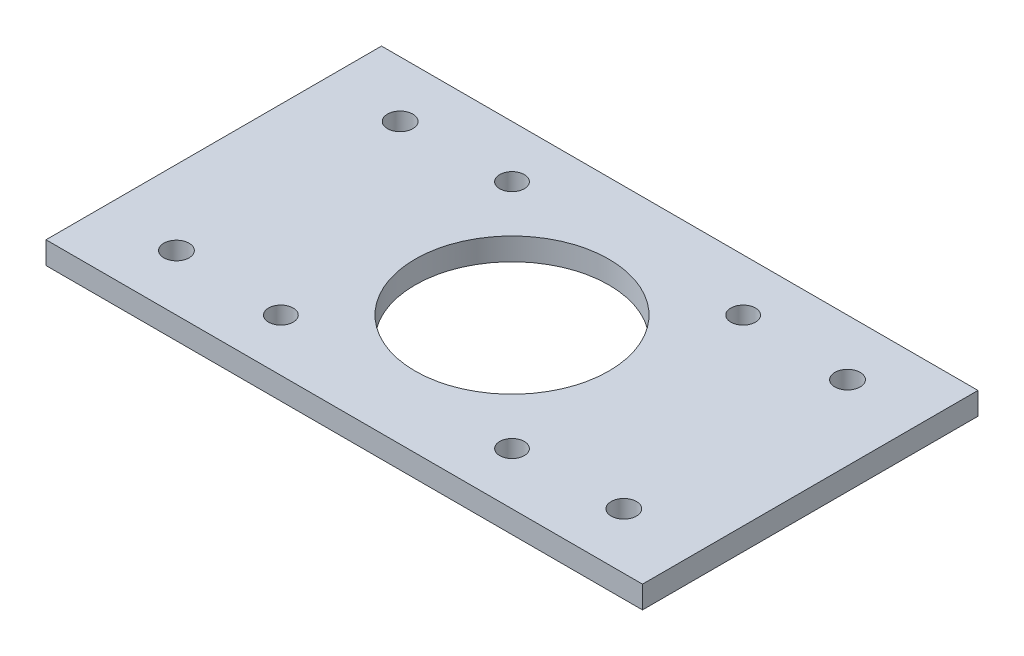
from build123d import *

# Parameters (mm, degrees)
SKETCH_1_W          = 80
SKETCH_1_H          = 45
EXTRUDE_1_DEPTH     = 3
SKETCH_2_R          = 1.65
CUT_EXTRUDE_1_DEPTH = 3
SKETCH_3_R          = 13
CUT_EXTRUDE_2_DEPTH = 10
SKETCH_5_R          = 1.7
CUT_EXTRUDE_4_DEPTH = 10


with BuildPart() as part:
    # 草图1 → 凸台-拉伸1 (new body)
    with BuildSketch(Plane(origin=(0, 0, 0), x_dir=(1, 0, 0), z_dir=(0, 1, 0))):
        Rectangle(SKETCH_1_W, SKETCH_1_H)
    extrude(amount=EXTRUDE_1_DEPTH)

    # 草图2 → 切除-拉伸1 (cut)
    with BuildSketch(Plane(origin=(0, 3, 0), x_dir=(1, 0, 0), z_dir=(0, 1, 0))):
        with Locations(Location((-15.5, 15.5, 0), (0, 0, 270))):
            Circle(SKETCH_2_R)
        with Locations(Location((15.5, 15.5, 0), (0, 0, 270))):
            Circle(SKETCH_2_R)
        with Locations(Location((-15.5, -15.5, 0), (0, 0, 270))):
            Circle(SKETCH_2_R)
        with Locations(Location((15.5, -15.5, 0), (0, 0, 270))):
            Circle(SKETCH_2_R)
    extrude(amount=-CUT_EXTRUDE_1_DEPTH, mode=Mode.SUBTRACT)

    # 草图3 → 切除-拉伸2 (cut)
    with BuildSketch(Plane(origin=(0, 3, 0), x_dir=(1, 0, 0), z_dir=(0, 1, 0))):
        with Locations(Location((0, 0, 0), (0, 0, 270))):
            Circle(SKETCH_3_R)
    extrude(amount=-CUT_EXTRUDE_2_DEPTH, mode=Mode.SUBTRACT)

    # 草图5 → 切除-拉伸4 (cut)
    with BuildSketch(Plane(origin=(0, 3, 0), x_dir=(1, 0, 0), z_dir=(0, 1, 0))):
        with Locations(Location((-30, 15, 0), (0, 0, 270))):
            Circle(SKETCH_5_R)
        with Locations(Location((30, 15, 0), (0, 0, 90))):
            Circle(SKETCH_5_R)
        with Locations(Location((-30, -15, 0), (0, 0, 90))):
            Circle(SKETCH_5_R)
        with Locations(Location((30, -15, 0), (0, 0, 270))):
            Circle(SKETCH_5_R)
    extrude(amount=-CUT_EXTRUDE_4_DEPTH, mode=Mode.SUBTRACT)


solid = part.part
